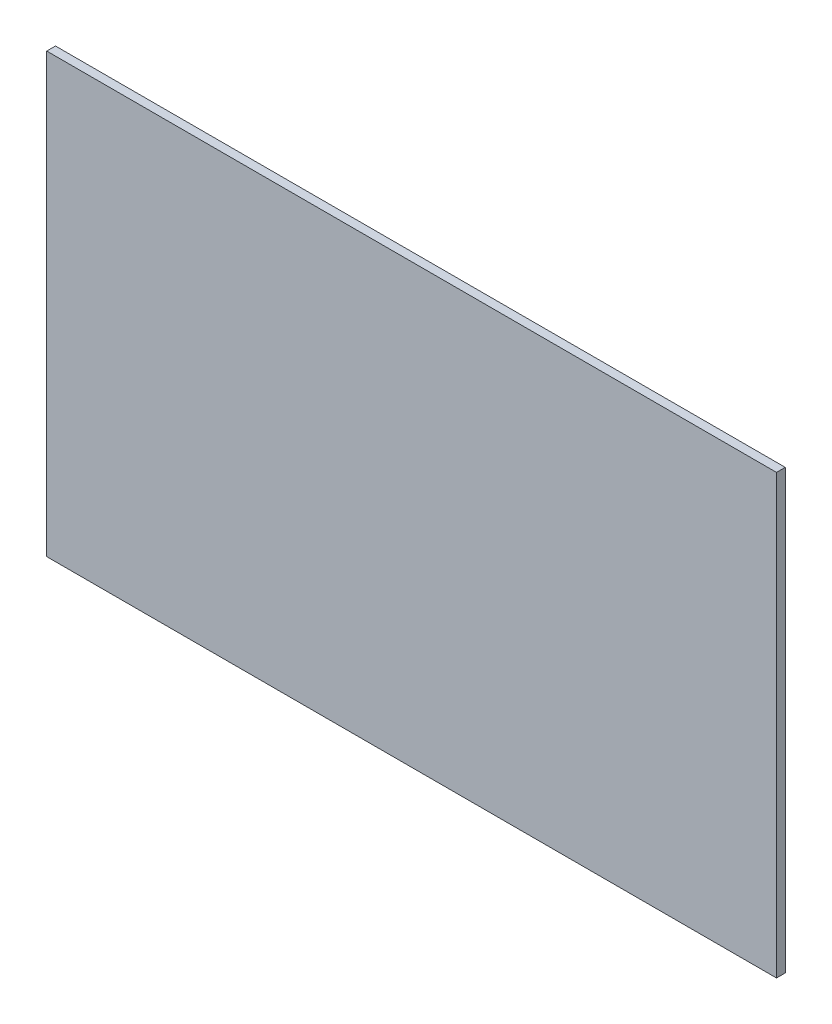
from build123d import *

# Parameters (mm, degrees)
SKETCH_1_W      = 250
SKETCH_1_H      = 150
EXTRUDE_1_DEPTH = 3


with BuildPart() as part:
    # Эскиз1 → Бобышка-Вытянуть1 (new body)
    with BuildSketch(Plane.XY):
        with Locations((20.545917525, -10.383246323)):
            Rectangle(SKETCH_1_W, SKETCH_1_H)
    extrude(amount=EXTRUDE_1_DEPTH)


solid = part.part
